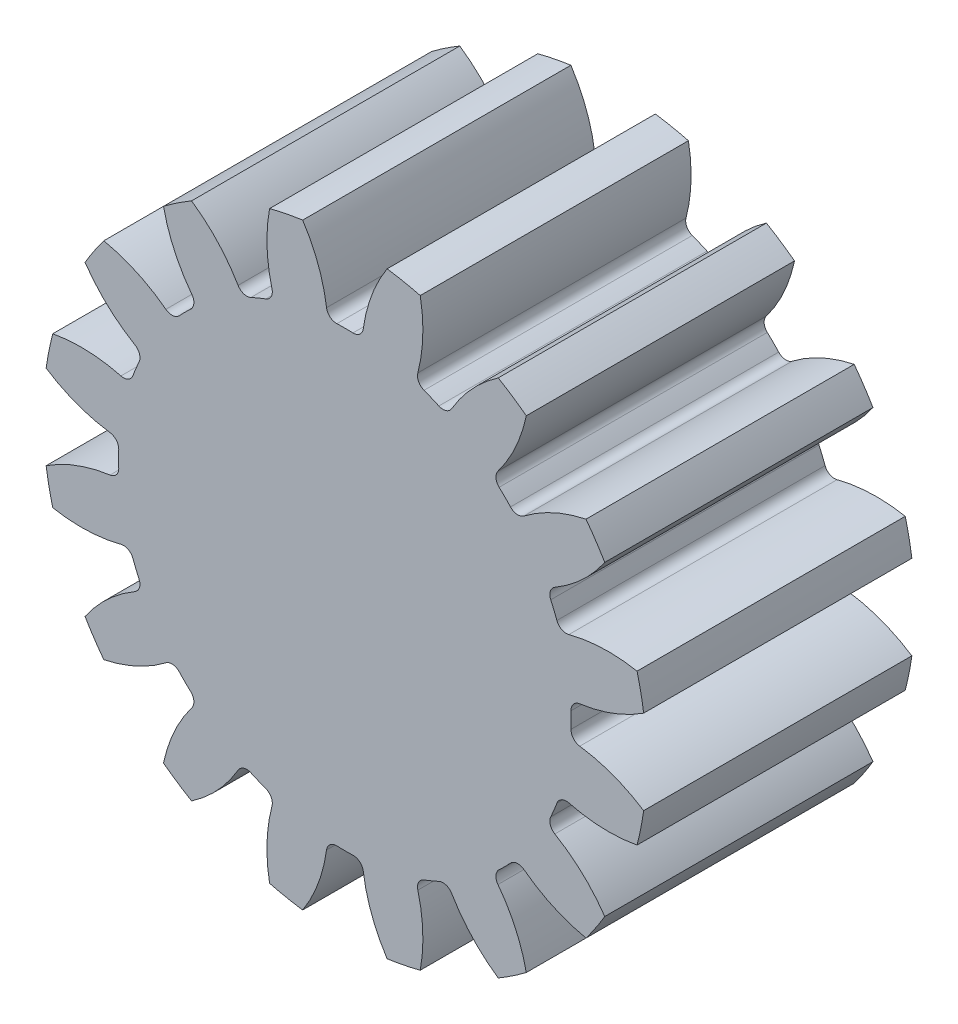
from build123d import *

# Parameters (mm, degrees)
SKETCH2_R                = 11.25
BOSS_EXTRUDE1_DEPTH      = 5
CUT_EXTRUDE1_DEPTH       = 17.67708008
FILLET1_R                = 0.375
CIRPATTERN1_COUNT        = 16
FILLET1_OF_CIRPATTERN1_R = 0.375
CUT_EXTRUDE2_DEPTH       = 9.5


with BuildPart() as part:
    # Sketch2 → Boss-Extrude1 (new, symmetric)
    with BuildSketch(Plane.XY):
        Circle(SKETCH2_R)
    extrude(amount=BOSS_EXTRUDE1_DEPTH, both=True)

    # Sketch3 → Cut-Extrude1 (cut, symmetric)
    with BuildSketch(Plane.XY):
        with BuildLine():
            ThreePointArc((0.647374884, 8.412628127), (0, 8.4375), (-0.647374884, 8.412628127))
            ThreePointArc((-0.647374884, 8.412628127), (-0.938843439, 9.834393243), (-1.574049944, 11.139338705))
            ThreePointArc((-1.574049944, 11.139338705), (0, 11.25), (1.574049944, 11.139338705))
            ThreePointArc((1.574049944, 11.139338705), (0.938843439, 9.834393243), (0.647374884, 8.412628127))
        make_face()
    cut_extrude1 = extrude(amount=CUT_EXTRUDE1_DEPTH, both=True, mode=Mode.SUBTRACT)

    # Fillet1
    fillet1_edges = [part.edges().sort_by_distance(p)[0] for p in [
        (0.647374884, 8.412628127, 0),
        (-0.647374884, 8.412628127, 0),
    ]]
    fillet(fillet1_edges, radius=FILLET1_R)

    # CirPattern1: Cut-Extrude1 ×16 about axis
    cirpattern1_axis = Axis((0, 0, -11), (0, 0, 1))
    for i in range(1, CIRPATTERN1_COUNT):
        add(cut_extrude1.rotate(cirpattern1_axis, i * 360 / CIRPATTERN1_COUNT), mode=Mode.SUBTRACT)

    # Fillet1 of CirPattern1
    fillet1_of_cirpattern1_edges = [part.edges().sort_by_distance(p)[0] for p in [
        (-2.621277002, 8.019994584, 0),
        (-3.817469812, 7.524515299, 0),
        (-5.490863226, 6.406389567, 0),
        (-6.406389567, 5.490863226, 0),
        (-7.524515299, 3.817469812, 0),
        (-8.019994584, 2.621277002, 0),
        (-8.412628127, 0.647374884, 0),
        (-8.412628127, -0.647374884, 0),
        (-8.019994584, -2.621277002, 0),
        (-7.524515299, -3.817469812, 0),
        (-6.406389567, -5.490863226, 0),
        (-5.490863226, -6.406389567, 0),
        (-3.817469812, -7.524515299, 0),
        (-2.621277002, -8.019994584, 0),
        (-0.647374884, -8.412628127, 0),
        (0.647374884, -8.412628127, 0),
        (2.621277002, -8.019994584, 0),
        (3.817469812, -7.524515299, 0),
        (5.490863226, -6.406389567, 0),
        (6.406389567, -5.490863226, 0),
        (7.524515299, -3.817469812, 0),
        (8.019994584, -2.621277002, 0),
        (8.412628127, -0.647374884, 0),
        (8.412628127, 0.647374884, 0),
        (8.019994584, 2.621277002, 0),
        (7.524515299, 3.817469812, 0),
        (6.406389567, 5.490863226, 0),
        (5.490863226, 6.406389567, 0),
        (3.817469812, 7.524515299, 0),
        (2.621277002, 8.019994584, 0),
    ]]
    fillet(fillet1_of_cirpattern1_edges, radius=FILLET1_OF_CIRPATTERN1_R)

    # Sketch4 → Cut-Extrude2 (cut)
    with BuildSketch(Plane(origin=(0, 0, -5), x_dir=(-1, 0, 0), z_dir=(0, 0, -1))):
        with BuildLine():
            Line((-1.5, 2), (1.5, 2))
            ThreePointArc((1.5, 2), (0, -2.5), (-1.5, 2))
        make_face()
    extrude(amount=-CUT_EXTRUDE2_DEPTH, mode=Mode.SUBTRACT)


solid = part.part
